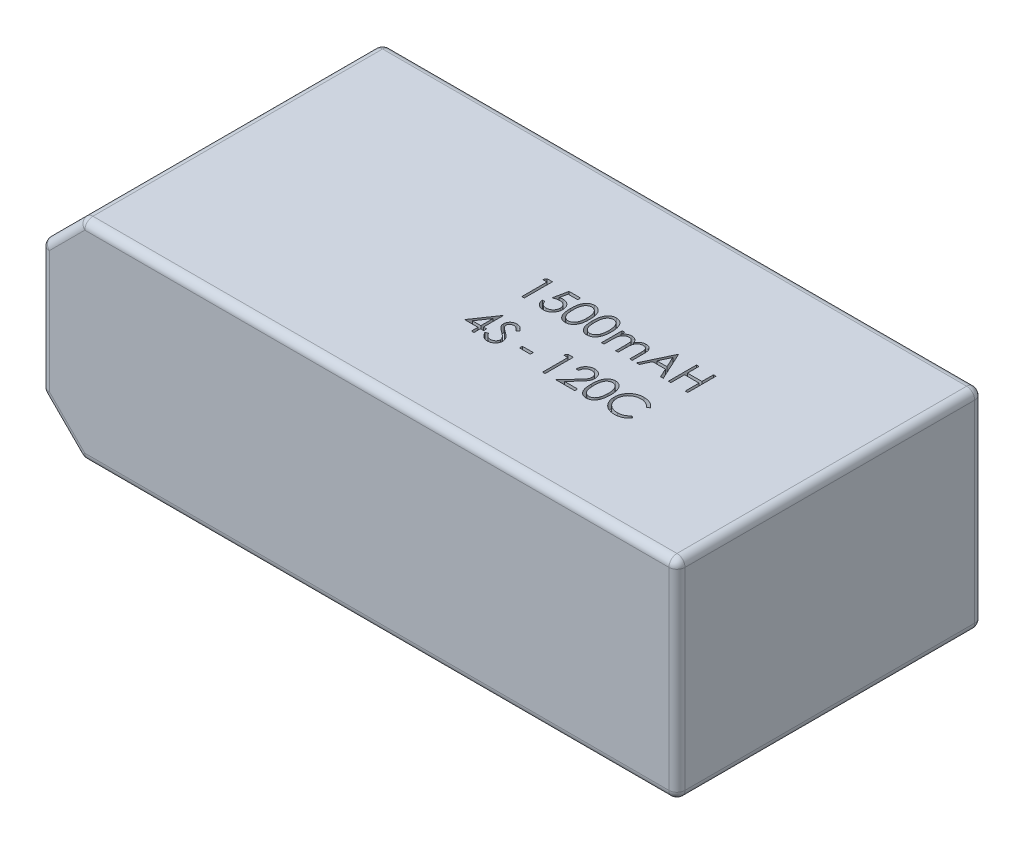
from build123d import *

# Parameters (mm, degrees)
SKETCH1_W           = 79
SKETCH1_H           = 38
BOSS_EXTRUDE1_DEPTH = 13
CHAMFER1_SIZE       = 5
FILLET1_R           = 1
SKETCH2_W           = 1.346153846
SKETCH2_H           = 0.358974359
CUT_EXTRUDE1_DEPTH  = 1


with BuildPart() as part:
    # Sketch1 → Boss-Extrude1 (new, symmetric)
    with BuildSketch(Plane(origin=(0, 0, 0), x_dir=(1, 0, 0), z_dir=(0, 1, 0))):
        Rectangle(SKETCH1_W, SKETCH1_H)
    extrude(amount=BOSS_EXTRUDE1_DEPTH, both=True)

    # Chamfer1
    chamfer1_edges = [part.edges().sort_by_distance(p)[0] for p in [
        (-39.5, 13, 0),
        (-39.5, -13, 0),
    ]]
    chamfer(chamfer1_edges, length=CHAMFER1_SIZE)

    # Fillet1
    fillet1_edges = [part.edges().sort_by_distance(p)[0] for p in [
        (2.5, 13, 19),
        (-34.5, 13, 0),
        (2.5, -13, 19),
        (-39.5, 0, 19),
        (-37, -10.5, 19),
        (-37, 10.5, 19),
        (-39.5, 0, -19),
        (-39.5, -8, 0),
        (-39.5, 8, 0),
        (-37, -10.5, -19),
        (-37, 10.5, -19),
        (-34.5, -13, 0),
        (39.5, 13, 0),
        (2.5, -13, -19),
        (39.5, -13, 0),
        (2.5, 13, -19),
        (39.5, 0, 19),
        (39.5, 0, -19),
    ]]
    fillet(fillet1_edges, radius=FILLET1_R)

    # Sketch2 → Cut-Extrude1 (cut)
    # profile 1 of 14: a face of its own
    with BuildSketch(Plane(origin=(0, 13, 0), x_dir=(1, 0, 0), z_dir=(0, 1, 0))):
        Polygon((0.878505609, 3.5), (1.525641026, 3.5), (1.525641026, 0), (1.211538462, 0), (1.211538462, 3.141025641), (0.673076923, 3.141025641), align=None)
    # profile 2 of 14: a face of its own
    with BuildSketch(Plane(origin=(0, 13, 0), x_dir=(1, 0, 0), z_dir=(0, 1, 0))):
        with BuildLine():
            Line((5.025641026, 3.5), (5.025641026, 3.141025641))
            Line((5.025641026, 3.141025641), (3.835136218, 3.141025641))
            Line((3.835136218, 3.141025641), (3.646534455, 2.220452724))
            add(Edge.make_bspline(
                [(3.646534455, 2.220452724), (3.68359033, 2.230682996), (3.755380225, 2.25050253), (3.861340086, 2.2725083), (3.96193229, 2.285773744), (4.02720766, 2.287585055), (4.058794071, 2.288461538)],
                knots=[0, 0, 0, 0, 1.100273476, 2.13160584, 3.095893838, 4, 4, 4, 4], degree=3))
            add(Edge.make_bspline(
                [(4.058794071, 2.288461538), (4.09787781, 2.287615603), (4.174726208, 2.285952282), (4.287165155, 2.269980432), (4.394498048, 2.244840518), (4.496500418, 2.209719996), (4.593360969, 2.164810263), (4.68418853, 2.108710322), (4.770346443, 2.043176991), (4.850289037, 1.967831979), (4.922813345, 1.884910363), (4.986579335, 1.795752492), (5.040741925, 1.701224829), (5.08430268, 1.600424221), (5.119087014, 1.494465067), (5.142239009, 1.382232485), (5.157655718, 1.264784365), (5.159378104, 1.184479795), (5.16025641, 1.143529647)],
                knots=[0, 0, 0, 0, 1.052922333, 2.070308379, 3.05430497, 4.020497103, 4.973039431, 5.925935799, 6.892292201, 7.88610001, 8.88166317, 9.857072816, 10.836096531, 11.812156883, 12.81219415, 13.836441305, 14.89672472, 16, 16, 16, 16], degree=3))
            add(Edge.make_bspline(
                [(5.16025641, 1.143529647), (5.159591335, 1.115007427), (5.158270172, 1.05834844), (5.151551585, 0.974204239), (5.138615869, 0.891841406), (5.121248145, 0.811249014), (5.098705727, 0.732579642), (5.071416673, 0.655608114), (5.038020645, 0.580813507), (5.00138927, 0.507488112), (4.960142792, 0.437289605), (4.914364285, 0.371640618), (4.865998793, 0.309556337), (4.813957408, 0.251702604), (4.757756413, 0.198459586), (4.698076446, 0.149511304), (4.635393727, 0.104029974), (4.568738485, 0.063861779), (4.499596002, 0.026898823), (4.426967784, -0.003424715), (4.352507084, -0.030535243), (4.275142208, -0.05214477), (4.195048396, -0.069077325), (4.11209362, -0.080577925), (4.02671295, -0.088954363), (3.968837938, -0.08947872), (3.939603365, -0.08974359)],
                knots=[0, 0, 0, 0, 1.056347294, 2.098418968, 3.122841568, 4.141288669, 5.149314143, 6.15115421, 7.162517403, 8.180376062, 9.185164535, 10.17417709, 11.141909838, 12.097768115, 13.052685741, 14.0056014, 14.954263652, 15.917497458, 16.885230207, 17.854509472, 18.828990115, 19.81800267, 20.826176721, 21.857883937, 22.917946725, 24, 24, 24, 24], degree=3))
            add(Edge.make_bspline(
                [(3.939603365, -0.08974359), (3.904729185, -0.089052752), (3.836118354, -0.08769361), (3.735597787, -0.073475124), (3.638883181, -0.053111208), (3.54675308, -0.022474938), (3.458381816, 0.015912357), (3.374959099, 0.064428528), (3.294353323, 0.119407632), (3.219841286, 0.184287985), (3.150685172, 0.255203667), (3.088778663, 0.332161308), (3.033645087, 0.41389075), (2.98616734, 0.500788904), (2.945669318, 0.592627435), (2.91385433, 0.689750436), (2.888175975, 0.79165044), (2.877312555, 0.86180395), (2.871794872, 0.897435897)],
                knots=[0, 0, 0, 0, 1.0467383, 2.05933395, 3.04377827, 4.011590433, 4.970194871, 5.932262533, 6.905835911, 7.896367577, 8.894135286, 9.877477877, 10.858688626, 11.851381753, 12.8477658, 13.868841284, 14.917554742, 16, 16, 16, 16], degree=3))
            Line((2.871794872, 0.897435897), (3.185897436, 0.897435897))
            add(Edge.make_bspline(
                [(3.185897436, 0.897435897), (3.193625993, 0.864059445), (3.20848071, 0.79990805), (3.241086458, 0.709776709), (3.280952334, 0.629457485), (3.328356682, 0.557887902), (3.384906713, 0.495478905), (3.449436142, 0.439861843), (3.521783865, 0.389686713), (3.602177095, 0.347863946), (3.686990174, 0.312195193), (3.775757384, 0.288443498), (3.86606173, 0.271742605), (3.927140101, 0.270070844), (3.957832532, 0.269230769)],
                knots=[0, 0, 0, 0, 1.136247022, 2.183929868, 3.172523383, 4.106158343, 5.02341133, 5.958108904, 6.928429099, 7.938127109, 8.96079061, 9.975095812, 10.982467395, 12, 12, 12, 12], degree=3))
            add(Edge.make_bspline(
                [(3.957832532, 0.269230769), (3.987790976, 0.270051547), (4.046779399, 0.271667666), (4.133590785, 0.284106678), (4.21740366, 0.303264249), (4.297391016, 0.331934104), (4.374952556, 0.366778822), (4.448126326, 0.411493898), (4.519029203, 0.462953917), (4.585457337, 0.521910547), (4.646296786, 0.586880241), (4.700052907, 0.656357635), (4.744829821, 0.730474481), (4.78256393, 0.807947634), (4.811217228, 0.889626191), (4.83165821, 0.975127366), (4.843661269, 1.064662347), (4.845312449, 1.125731656), (4.846153846, 1.156850962)],
                knots=[0, 0, 0, 0, 1.027316725, 2.022795036, 3.002884548, 3.971462791, 4.93288096, 5.914575861, 6.907176829, 7.935150275, 8.956128384, 9.956726525, 10.942570165, 11.921478529, 12.907843606, 13.90538589, 14.932640048, 16, 16, 16, 16], degree=3))
            add(Edge.make_bspline(
                [(4.846153846, 1.156850962), (4.845495367, 1.184926713), (4.844206487, 1.239881002), (4.833675917, 1.320280209), (4.815358944, 1.396353251), (4.789935064, 1.468467485), (4.757655557, 1.536690927), (4.718209244, 1.601093987), (4.670855846, 1.660827821), (4.616763958, 1.715920374), (4.557505917, 1.766765249), (4.492062174, 1.810109336), (4.421802247, 1.846573253), (4.347572648, 1.878041252), (4.267607749, 1.900641997), (4.183491117, 1.917609882), (4.094314409, 1.927425245), (4.033343721, 1.928787134), (4.002003205, 1.929487179)],
                knots=[0, 0, 0, 0, 1.045622112, 2.046656509, 3.013763289, 3.955457236, 4.890082067, 5.820317437, 6.762574623, 7.722996705, 8.69280354, 9.665887285, 10.63943826, 11.638615906, 12.663482002, 13.728887084, 14.832589034, 16, 16, 16, 16], degree=3))
            add(Edge.make_bspline(
                [(4.002003205, 1.929487179), (3.974874276, 1.928906588), (3.918859921, 1.927707815), (3.832937094, 1.918881318), (3.742645371, 1.904642024), (3.648330876, 1.885055776), (3.549710368, 1.859424699), (3.446991967, 1.828710199), (3.3399597, 1.7919882), (3.267841976, 1.764255986), (3.230769231, 1.75)],
                knots=[0, 0, 0, 0, 0.817624296, 1.688186739, 2.600797293, 3.572016777, 4.590301741, 5.671205678, 6.80286297, 8, 8, 8, 8], degree=3))
            Line((3.230769231, 1.75), (3.58974359, 3.5))
            Line((3.58974359, 3.5), (5.025641026, 3.5))
        make_face()
    # profile 3 of 14: a face of its own
    with BuildSketch(Plane(origin=(0, 13, 0), x_dir=(1, 0, 0), z_dir=(0, 1, 0))):
        with BuildLine():
            add(Edge.make_bspline(
                [(5.519230769, 1.748597756), (5.519558787, 1.804695144), (5.520195967, 1.913665128), (5.527284388, 2.07244977), (5.539059731, 2.221410059), (5.555197103, 2.360553125), (5.574835084, 2.48991489), (5.60105057, 2.609149647), (5.630863373, 2.718809254), (5.665415819, 2.819251302), (5.704403608, 2.911829005), (5.746837868, 2.998254207), (5.794402663, 3.078396139), (5.844379576, 3.153533929), (5.898791647, 3.222437624), (5.956090438, 3.286080287), (6.018512314, 3.342991037), (6.083935322, 3.394837339), (6.152951787, 3.440286811), (6.223594453, 3.48031955), (6.296349559, 3.514519417), (6.371415742, 3.541409853), (6.4481183, 3.5636207), (6.526725366, 3.578809647), (6.60736673, 3.588366556), (6.661798165, 3.589280224), (6.689403045, 3.58974359)],
                knots=[0, 0, 0, 0, 1.646270934, 3.197905019, 4.663502075, 6.030701355, 7.308322542, 8.50163776, 9.611534131, 10.641858119, 11.616356847, 12.558055219, 13.465016945, 14.349605745, 15.204443733, 16.039544428, 16.859896111, 17.680448484, 18.487036065, 19.28249412, 20.06191084, 20.843045899, 21.620316918, 22.403196591, 23.190181807, 24, 24, 24, 24], degree=3))
            add(Edge.make_bspline(
                [(6.689403045, 3.58974359), (6.717238523, 3.589255775), (6.772594532, 3.588285664), (6.854434907, 3.578961721), (6.934384589, 3.563490598), (7.012102728, 3.541569623), (7.088227714, 3.514373947), (7.162164122, 3.48028683), (7.234371204, 3.440607962), (7.303701491, 3.393984085), (7.370916107, 3.342001809), (7.43436407, 3.28323914), (7.494051155, 3.218289421), (7.550726461, 3.147847557), (7.602782058, 3.070562472), (7.65235549, 2.987778362), (7.696727526, 2.898047497), (7.739462201, 2.80286703), (7.776349188, 2.699603371), (7.809615433, 2.58883861), (7.836494402, 2.469264423), (7.858883674, 2.341508178), (7.87622857, 2.205100695), (7.888861212, 2.060334379), (7.895534297, 1.907113989), (7.896790999, 1.80235614), (7.897435897, 1.748597756)],
                knots=[0, 0, 0, 0, 0.810914788, 1.612654377, 2.396697861, 3.181598691, 3.963628158, 4.749916497, 5.551656086, 6.361998678, 7.18212741, 8.025565596, 8.878627764, 9.750805457, 10.657531673, 11.591944965, 12.560506719, 13.57287815, 14.630710178, 15.753379473, 16.941251878, 18.199788006, 19.531962791, 20.947069417, 22.433333509, 24, 24, 24, 24], degree=3))
            add(Edge.make_bspline(
                [(7.897435897, 1.748597756), (7.896784313, 1.695073848), (7.895514727, 1.590784697), (7.88893602, 1.438253721), (7.875977389, 1.294255678), (7.859767401, 1.158445216), (7.837316438, 1.031387597), (7.809711272, 0.912643148), (7.779060949, 0.801699077), (7.741226155, 0.699464265), (7.699815444, 0.604512542), (7.654760248, 0.515845394), (7.606490422, 0.432679101), (7.553901677, 0.355679354), (7.497848264, 0.284300697), (7.437130475, 0.219803074), (7.37345989, 0.160632402), (7.306047474, 0.107980775), (7.235635923, 0.06189597), (7.163676846, 0.02068212), (7.088893463, -0.012550575), (7.01298051, -0.041085616), (6.934852144, -0.062886068), (6.854605753, -0.077959923), (6.772649517, -0.088531772), (6.717247952, -0.089338252), (6.689403045, -0.08974359)],
                knots=[0, 0, 0, 0, 1.561518951, 3.042555995, 4.452378317, 5.7783523, 7.031515105, 8.214008947, 9.334062868, 10.386615937, 11.391082383, 12.354592575, 13.286541444, 14.194233754, 15.072674879, 15.931287219, 16.775624067, 17.606195743, 18.42308326, 19.229000347, 20.022332153, 20.807536673, 21.593273796, 22.3848459, 23.188221202, 24, 24, 24, 24], degree=3))
            add(Edge.make_bspline(
                [(6.689403045, -0.08974359), (6.661798931, -0.089277234), (6.607369006, -0.088357672), (6.526716581, -0.078843941), (6.448434137, -0.063548438), (6.372135383, -0.042131834), (6.297428868, -0.015916997), (6.225332581, 0.018236686), (6.155044898, 0.057570755), (6.086753342, 0.102366177), (6.021741181, 0.15368786), (5.959642575, 0.210452149), (5.902017556, 0.27407556), (5.848383461, 0.343553483), (5.797409372, 0.418246725), (5.750519999, 0.499175098), (5.707149145, 0.586017709), (5.667505654, 0.67933562), (5.632356991, 0.780490547), (5.601309283, 0.890639726), (5.576795125, 1.010755362), (5.55581217, 1.139872729), (5.538887787, 1.278546659), (5.527333462, 1.426852438), (5.520192147, 1.584697647), (5.519557076, 1.692967421), (5.519230769, 1.748597756)],
                knots=[0, 0, 0, 0, 0.810891512, 1.598919785, 2.382837074, 3.152667961, 3.926044502, 4.706494248, 5.493654104, 6.291793342, 7.103789334, 7.925228297, 8.761435821, 9.622817696, 10.50288917, 11.416980706, 12.369136599, 13.353924996, 14.394355917, 15.514179734, 16.714354668, 17.994756427, 19.357759367, 20.818452758, 22.365282078, 24, 24, 24, 24], degree=3))
        make_face()
        with BuildLine():
            add(Edge.make_bspline(
                [(5.833333333, 1.75), (5.83345278, 1.703251301), (5.833684604, 1.612521256), (5.839740804, 1.480677995), (5.847991036, 1.357707667), (5.858632333, 1.24345413), (5.874435282, 1.138304118), (5.89214207, 1.041534435), (5.913690159, 0.953657197), (5.939185177, 0.874069387), (5.968224274, 0.801420318), (5.999930138, 0.733819103), (6.033990861, 0.670467167), (6.072110011, 0.611933558), (6.113625075, 0.558027394), (6.157598334, 0.507794562), (6.205670918, 0.462997581), (6.27217466, 0.409270726), (6.359971135, 0.353751592), (6.47059159, 0.305405502), (6.584260041, 0.275023046), (6.661411291, 0.27115929), (6.699919872, 0.269230769)],
                knots=[0, 0, 0, 0, 1.459021318, 2.831673884, 4.118529203, 5.306027144, 6.411944654, 7.436330062, 8.375795394, 9.233974572, 10.042671642, 10.816086306, 11.563610507, 12.285937304, 12.993564865, 13.685989202, 14.367179055, 15.041617293, 16.353048772, 17.594441528, 18.799311195, 20, 20, 20, 20], degree=3))
            add(Edge.make_bspline(
                [(6.699919872, 0.269230769), (6.738677543, 0.27082855), (6.816112867, 0.274020813), (6.929246662, 0.30481955), (7.039076932, 0.35128909), (7.125148872, 0.406236595), (7.190631416, 0.458564925), (7.237548406, 0.503179573), (7.280610454, 0.55313544), (7.321452529, 0.607034736), (7.358911605, 0.66590722), (7.392974742, 0.729469796), (7.42405809, 0.797898973), (7.441767136, 0.845668713), (7.450821314, 0.870092147)],
                knots=[0, 0, 0, 0, 1.353760809, 2.704726607, 4.075137775, 5.516104923, 6.260822281, 7.007110065, 7.778089737, 8.566572457, 9.372053459, 10.217411131, 11.088608312, 12, 12, 12, 12], degree=3))
            add(Edge.make_bspline(
                [(7.450821314, 0.870092147), (7.461373082, 0.901321887), (7.482797696, 0.964731651), (7.51040947, 1.063095303), (7.532154869, 1.166298067), (7.551718235, 1.273723184), (7.565071291, 1.386162885), (7.575819104, 1.503269269), (7.582149791, 1.625130631), (7.582934542, 1.707925622), (7.583333333, 1.75)],
                knots=[0, 0, 0, 0, 0.884706709, 1.796334032, 2.740027952, 3.714592787, 4.726048262, 5.777819803, 6.87074269, 8, 8, 8, 8], degree=3))
            add(Edge.make_bspline(
                [(7.583333333, 1.75), (7.582783144, 1.792067573), (7.581706856, 1.874360737), (7.577592869, 1.994878918), (7.566969294, 2.109346679), (7.555170175, 2.218257152), (7.537772954, 2.321007454), (7.519015147, 2.418457759), (7.493813935, 2.509400784), (7.46689416, 2.595260366), (7.436083765, 2.675061021), (7.40216803, 2.749174807), (7.365946271, 2.817959532), (7.326604031, 2.881226473), (7.284608348, 2.939259016), (7.238850799, 2.990893611), (7.191146426, 3.037730579), (7.12432924, 3.091193148), (7.03685495, 3.145704843), (6.928009303, 3.195870603), (6.814738659, 3.224678896), (6.738165205, 3.228740583), (6.699919872, 3.230769231)],
                knots=[0, 0, 0, 0, 1.31362396, 2.569729283, 3.763502607, 4.902122613, 5.988968491, 7.01645872, 7.998833611, 8.933434873, 9.825090667, 10.667526885, 11.477055099, 12.250526234, 12.991942729, 13.710640831, 14.402115721, 15.076753259, 16.378508321, 17.609869233, 18.806226677, 20, 20, 20, 20], degree=3))
            add(Edge.make_bspline(
                [(6.699919872, 3.230769231), (6.66120928, 3.228737784), (6.583717574, 3.22467119), (6.469269619, 3.195977936), (6.359565268, 3.14596497), (6.272322293, 3.091012598), (6.205458507, 3.038674287), (6.158375813, 2.993287833), (6.114229641, 2.943641578), (6.073561941, 2.889239663), (6.035472658, 2.830774296), (6.000491645, 2.767785531), (5.968974315, 2.699954167), (5.939889779, 2.627337732), (5.914316991, 2.547756787), (5.893223028, 2.459987794), (5.873735975, 2.363525902), (5.859940706, 2.257806394), (5.84767695, 2.14352424), (5.839795602, 2.020246922), (5.833664345, 1.888182542), (5.83344588, 1.796983383), (5.833333333, 1.75)],
                knots=[0, 0, 0, 0, 1.207732386, 2.417664972, 3.655092373, 4.956220595, 5.625982001, 6.301752483, 6.994047911, 7.697131622, 8.419323945, 9.170223765, 9.943494443, 10.752040957, 11.610060368, 12.549350801, 13.567764191, 14.679664412, 15.874934091, 17.154273443, 18.533957287, 20, 20, 20, 20], degree=3))
        make_face(mode=Mode.SUBTRACT)
    # profile 4 of 14: a face of its own
    with BuildSketch(Plane(origin=(0, 13, 0), x_dir=(1, 0, 0), z_dir=(0, 1, 0))):
        with BuildLine():
            add(Edge.make_bspline(
                [(8.211538462, 1.748597756), (8.21186648, 1.804695144), (8.21250366, 1.913665128), (8.219592081, 2.07244977), (8.231367423, 2.221410059), (8.247504796, 2.360553125), (8.267142776, 2.48991489), (8.293358263, 2.609149647), (8.323171065, 2.718809254), (8.357723511, 2.819251302), (8.3967113, 2.911829005), (8.439145561, 2.998254207), (8.486710355, 3.078396139), (8.536687268, 3.153533929), (8.59109934, 3.222437624), (8.64839813, 3.286080287), (8.710820007, 3.342991037), (8.776243015, 3.394837339), (8.845259479, 3.440286811), (8.915902145, 3.48031955), (8.988657251, 3.514519417), (9.063723434, 3.541409853), (9.140425992, 3.5636207), (9.219033059, 3.578809647), (9.299674423, 3.588366556), (9.354105857, 3.589280224), (9.381710737, 3.58974359)],
                knots=[0, 0, 0, 0, 1.646270934, 3.197905019, 4.663502075, 6.030701355, 7.308322542, 8.50163776, 9.611534131, 10.641858119, 11.616356847, 12.558055219, 13.465016945, 14.349605745, 15.204443733, 16.039544428, 16.859896111, 17.680448484, 18.487036065, 19.28249412, 20.06191084, 20.843045899, 21.620316918, 22.403196591, 23.190181807, 24, 24, 24, 24], degree=3))
            add(Edge.make_bspline(
                [(9.381710737, 3.58974359), (9.409546216, 3.589255775), (9.464902225, 3.588285664), (9.5467426, 3.578961721), (9.626692282, 3.563490598), (9.70441042, 3.541569623), (9.780535407, 3.514373947), (9.854471814, 3.48028683), (9.926678896, 3.440607962), (9.996009183, 3.393984085), (10.063223799, 3.342001809), (10.126671762, 3.28323914), (10.186358848, 3.218289421), (10.243034153, 3.147847557), (10.29508975, 3.070562472), (10.344663183, 2.987778362), (10.389035218, 2.898047497), (10.431769894, 2.80286703), (10.46865688, 2.699603371), (10.501923126, 2.58883861), (10.528802094, 2.469264423), (10.551191367, 2.341508178), (10.568536262, 2.205100695), (10.581168905, 2.060334379), (10.58784199, 1.907113989), (10.589098691, 1.80235614), (10.58974359, 1.748597756)],
                knots=[0, 0, 0, 0, 0.810914788, 1.612654377, 2.396697861, 3.181598691, 3.963628158, 4.749916497, 5.551656086, 6.361998678, 7.18212741, 8.025565596, 8.878627764, 9.750805457, 10.657531673, 11.591944965, 12.560506719, 13.57287815, 14.630710178, 15.753379473, 16.941251878, 18.199788006, 19.531962791, 20.947069417, 22.433333509, 24, 24, 24, 24], degree=3))
            add(Edge.make_bspline(
                [(10.58974359, 1.748597756), (10.589092005, 1.695073848), (10.587822419, 1.590784697), (10.581243713, 1.438253721), (10.568285081, 1.294255678), (10.552075093, 1.158445216), (10.52962413, 1.031387597), (10.502018964, 0.912643148), (10.471368641, 0.801699077), (10.433533847, 0.699464265), (10.392123137, 0.604512542), (10.34706794, 0.515845394), (10.298798114, 0.432679101), (10.246209369, 0.355679354), (10.190155956, 0.284300697), (10.129438167, 0.219803074), (10.065767582, 0.160632402), (9.998355166, 0.107980775), (9.927943615, 0.06189597), (9.855984538, 0.02068212), (9.781201155, -0.012550575), (9.705288202, -0.041085616), (9.627159836, -0.062886068), (9.546913445, -0.077959923), (9.464957209, -0.088531772), (9.409555644, -0.089338252), (9.381710737, -0.08974359)],
                knots=[0, 0, 0, 0, 1.561518951, 3.042555995, 4.452378317, 5.7783523, 7.031515105, 8.214008947, 9.334062868, 10.386615937, 11.391082383, 12.354592575, 13.286541444, 14.194233754, 15.072674879, 15.931287219, 16.775624067, 17.606195743, 18.42308326, 19.229000347, 20.022332153, 20.807536673, 21.593273796, 22.3848459, 23.188221202, 24, 24, 24, 24], degree=3))
            add(Edge.make_bspline(
                [(9.381710737, -0.08974359), (9.354106623, -0.089277234), (9.299676698, -0.088357672), (9.219024273, -0.078843941), (9.14074183, -0.063548438), (9.064443076, -0.042131834), (8.98973656, -0.015916997), (8.917640274, 0.018236686), (8.84735259, 0.057570755), (8.779061034, 0.102366177), (8.714048873, 0.15368786), (8.651950268, 0.210452149), (8.594325249, 0.27407556), (8.540691153, 0.343553483), (8.489717065, 0.418246725), (8.442827691, 0.499175098), (8.399456837, 0.586017709), (8.359813347, 0.67933562), (8.324664683, 0.780490547), (8.293616975, 0.890639726), (8.269102818, 1.010755362), (8.248119862, 1.139872729), (8.231195479, 1.278546659), (8.219641154, 1.426852438), (8.212499839, 1.584697647), (8.211864768, 1.692967421), (8.211538462, 1.748597756)],
                knots=[0, 0, 0, 0, 0.810891512, 1.598919785, 2.382837074, 3.152667961, 3.926044502, 4.706494248, 5.493654104, 6.291793342, 7.103789334, 7.925228297, 8.761435821, 9.622817696, 10.50288917, 11.416980706, 12.369136599, 13.353924996, 14.394355917, 15.514179734, 16.714354668, 17.994756427, 19.357759367, 20.818452758, 22.365282078, 24, 24, 24, 24], degree=3))
        make_face()
        with BuildLine():
            add(Edge.make_bspline(
                [(8.525641026, 1.75), (8.525760473, 1.703251301), (8.525992296, 1.612521256), (8.532048497, 1.480677995), (8.540298729, 1.357707667), (8.550940026, 1.24345413), (8.566742974, 1.138304118), (8.584449762, 1.041534435), (8.605997852, 0.953657197), (8.63149287, 0.874069387), (8.660531966, 0.801420318), (8.69223783, 0.733819103), (8.726298553, 0.670467167), (8.764417704, 0.611933558), (8.805932767, 0.558027394), (8.849906026, 0.507794562), (8.89797861, 0.462997581), (8.964482353, 0.409270726), (9.052278827, 0.353751592), (9.162899282, 0.305405502), (9.276567733, 0.275023046), (9.353718984, 0.27115929), (9.392227564, 0.269230769)],
                knots=[0, 0, 0, 0, 1.459021318, 2.831673884, 4.118529203, 5.306027144, 6.411944654, 7.436330062, 8.375795394, 9.233974572, 10.042671642, 10.816086306, 11.563610507, 12.285937304, 12.993564865, 13.685989202, 14.367179055, 15.041617293, 16.353048772, 17.594441528, 18.799311195, 20, 20, 20, 20], degree=3))
            add(Edge.make_bspline(
                [(9.392227564, 0.269230769), (9.430985236, 0.27082855), (9.508420559, 0.274020813), (9.621554354, 0.30481955), (9.731384624, 0.35128909), (9.817456564, 0.406236595), (9.882939108, 0.458564925), (9.929856098, 0.503179573), (9.972918146, 0.55313544), (10.013760221, 0.607034736), (10.051219297, 0.66590722), (10.085282435, 0.729469796), (10.116365782, 0.797898973), (10.134074828, 0.845668713), (10.143129006, 0.870092147)],
                knots=[0, 0, 0, 0, 1.353760809, 2.704726607, 4.075137775, 5.516104923, 6.260822281, 7.007110065, 7.778089737, 8.566572457, 9.372053459, 10.217411131, 11.088608312, 12, 12, 12, 12], degree=3))
            add(Edge.make_bspline(
                [(10.143129006, 0.870092147), (10.153680774, 0.901321887), (10.175105388, 0.964731651), (10.202717162, 1.063095303), (10.224462562, 1.166298067), (10.244025927, 1.273723184), (10.257378983, 1.386162885), (10.268126796, 1.503269269), (10.274457483, 1.625130631), (10.275242234, 1.707925622), (10.275641026, 1.75)],
                knots=[0, 0, 0, 0, 0.884706709, 1.796334032, 2.740027952, 3.714592787, 4.726048262, 5.777819803, 6.87074269, 8, 8, 8, 8], degree=3))
            add(Edge.make_bspline(
                [(10.275641026, 1.75), (10.275090836, 1.792067573), (10.274014549, 1.874360737), (10.269900561, 1.994878918), (10.259276986, 2.109346679), (10.247477868, 2.218257152), (10.230080647, 2.321007454), (10.21132284, 2.418457759), (10.186121627, 2.509400784), (10.159201852, 2.595260366), (10.128391457, 2.675061021), (10.094475723, 2.749174807), (10.058253964, 2.817959532), (10.018911723, 2.881226473), (9.97691604, 2.939259016), (9.931158491, 2.990893611), (9.883454118, 3.037730579), (9.816636932, 3.091193148), (9.729162643, 3.145704843), (9.620316995, 3.195870603), (9.507046351, 3.224678896), (9.430472897, 3.228740583), (9.392227564, 3.230769231)],
                knots=[0, 0, 0, 0, 1.31362396, 2.569729283, 3.763502607, 4.902122613, 5.988968491, 7.01645872, 7.998833611, 8.933434873, 9.825090667, 10.667526885, 11.477055099, 12.250526234, 12.991942729, 13.710640831, 14.402115721, 15.076753259, 16.378508321, 17.609869233, 18.806226677, 20, 20, 20, 20], degree=3))
            add(Edge.make_bspline(
                [(9.392227564, 3.230769231), (9.353516972, 3.228737784), (9.276025266, 3.22467119), (9.161577312, 3.195977936), (9.05187296, 3.14596497), (8.964629985, 3.091012598), (8.897766199, 3.038674287), (8.850683505, 2.993287833), (8.806537333, 2.943641578), (8.765869633, 2.889239663), (8.72778035, 2.830774296), (8.692799337, 2.767785531), (8.661282008, 2.699954167), (8.632197471, 2.627337732), (8.606624683, 2.547756787), (8.58553072, 2.459987794), (8.566043667, 2.363525902), (8.552248398, 2.257806394), (8.539984642, 2.14352424), (8.532103295, 2.020246922), (8.525972037, 1.888182542), (8.525753573, 1.796983383), (8.525641026, 1.75)],
                knots=[0, 0, 0, 0, 1.207732386, 2.417664972, 3.655092373, 4.956220595, 5.625982001, 6.301752483, 6.994047911, 7.697131622, 8.419323945, 9.170223765, 9.943494443, 10.752040957, 11.610060368, 12.549350801, 13.567764191, 14.679664412, 15.874934091, 17.154273443, 18.533957287, 20, 20, 20, 20], degree=3))
        make_face(mode=Mode.SUBTRACT)
    # profile 5 of 14: a face of its own
    with BuildSketch(Plane(origin=(0, 13, 0), x_dir=(1, 0, 0), z_dir=(0, 1, 0))):
        with BuildLine():
            Line((11.128205128, 2.557692308), (11.442307692, 2.557692308))
            Line((11.442307692, 2.557692308), (11.442307692, 2.11318109))
            add(Edge.make_bspline(
                [(11.442307692, 2.11318109), (11.470591642, 2.152068691), (11.524786402, 2.226581065), (11.613652054, 2.324771349), (11.702428167, 2.408099503), (11.766361549, 2.451842375), (11.797075321, 2.472856571)],
                knots=[0, 0, 0, 0, 1.134379233, 2.173579362, 3.122582517, 4, 4, 4, 4], degree=3))
            add(Edge.make_bspline(
                [(11.797075321, 2.472856571), (11.838939983, 2.492861936), (11.921937882, 2.532523149), (12.053357107, 2.572756708), (12.187831777, 2.597481809), (12.278639991, 2.600863183), (12.32431891, 2.602564103)],
                knots=[0, 0, 0, 0, 1.014936303, 2.012140481, 3.000054389, 4, 4, 4, 4], degree=3))
            add(Edge.make_bspline(
                [(12.32431891, 2.602564103), (12.355211907, 2.601518812), (12.416347486, 2.599450238), (12.506931576, 2.585990202), (12.594790188, 2.562724029), (12.679404217, 2.530316705), (12.759124896, 2.491070018), (12.832214094, 2.445020311), (12.897838302, 2.393323235), (12.955964354, 2.333644302), (13.008233379, 2.264307704), (13.056312226, 2.183443455), (13.100737438, 2.089235794), (13.125358747, 2.020869253), (13.138321314, 1.984875801)],
                knots=[0, 0, 0, 0, 1.009824226, 1.998387844, 2.986035974, 3.974953746, 4.955485308, 5.885931332, 6.793869504, 7.679848016, 8.601185859, 9.625726857, 10.749998409, 12, 12, 12, 12], degree=3))
            add(Edge.make_bspline(
                [(13.138321314, 1.984875801), (13.152032565, 2.009600221), (13.179014383, 2.058254406), (13.22432002, 2.127112668), (13.271787816, 2.19151946), (13.321822309, 2.251525884), (13.374246896, 2.306835614), (13.429308296, 2.357631516), (13.486693078, 2.40413173), (13.566485318, 2.458454889), (13.670297925, 2.516156071), (13.80118604, 2.566184515), (13.937336211, 2.597100643), (14.02975391, 2.600730916), (14.076422276, 2.602564103)],
                knots=[0, 0, 0, 0, 0.86119277, 1.694706429, 2.50939023, 3.298075842, 4.073795165, 4.829715201, 5.57930267, 6.321991688, 7.768977793, 9.186738141, 10.579381044, 12, 12, 12, 12], degree=3))
            add(Edge.make_bspline(
                [(14.076422276, 2.602564103), (14.119303738, 2.600946882), (14.203226925, 2.597781823), (14.32540419, 2.57292835), (14.439345996, 2.530250703), (14.544823072, 2.472017066), (14.639982885, 2.398837883), (14.722699194, 2.311769046), (14.792469558, 2.211426423), (14.838048198, 2.117034434), (14.868963462, 2.033699101), (14.888024696, 1.96269281), (14.904864391, 1.884541257), (14.918845636, 1.799150995), (14.929064189, 1.706220387), (14.936634904, 1.605901511), (14.941758978, 1.498116399), (14.94212105, 1.423750899), (14.942307692, 1.385416667)],
                knots=[0, 0, 0, 0, 1.209669288, 2.367440248, 3.500751976, 4.631527125, 5.755587489, 6.87532382, 8.007944318, 9.190864318, 9.82315674, 10.514484317, 11.263564316, 12.079023757, 12.955305781, 13.901327259, 14.918167583, 16, 16, 16, 16], degree=3))
            Line((14.942307692, 1.385416667), (14.942307692, 0))
            Line((14.942307692, 0), (14.628205128, 0))
            Line((14.628205128, 0), (14.628205128, 1.38681891))
            add(Edge.make_bspline(
                [(14.628205128, 1.38681891), (14.628127245, 1.419539484), (14.627977566, 1.482423451), (14.625283934, 1.572675902), (14.62020862, 1.654944259), (14.614273982, 1.729116348), (14.606030172, 1.795365136), (14.59538424, 1.853557555), (14.584106561, 1.904151366), (14.565370569, 1.960237414), (14.535422678, 2.022107624), (14.489805198, 2.0888312), (14.432335092, 2.146912), (14.365974935, 2.197330317), (14.29042649, 2.238323958), (14.207161767, 2.267599968), (14.116697716, 2.285722846), (14.054074927, 2.287528862), (14.021734776, 2.288461538)],
                knots=[0, 0, 0, 0, 1.253487763, 2.409012846, 3.458416907, 4.410876679, 5.259312806, 6.014470957, 6.676830364, 7.243083969, 8.276244668, 9.299465089, 10.325150304, 11.392391894, 12.482080715, 13.603491619, 14.762376348, 16, 16, 16, 16], degree=3))
            add(Edge.make_bspline(
                [(14.021734776, 2.288461538), (13.982064821, 2.287045381), (13.90366191, 2.284246516), (13.789216424, 2.255672643), (13.679245407, 2.212592392), (13.577030274, 2.150159935), (13.483002484, 2.075351571), (13.402102906, 1.986401975), (13.33527072, 1.885772048), (13.290016744, 1.792625346), (13.261427443, 1.708955902), (13.242550527, 1.63585853), (13.227867136, 1.552776962), (13.214096607, 1.460269472), (13.205108879, 1.357699291), (13.196940506, 1.24554089), (13.193119644, 1.123456931), (13.192585185, 1.038830242), (13.192307692, 0.994891827)],
                knots=[0, 0, 0, 0, 1.090531906, 2.155305635, 3.229839962, 4.33261226, 5.44038871, 6.529323825, 7.629011124, 8.757537029, 9.370236727, 10.061839251, 10.834451254, 11.692844982, 12.636905849, 13.66920014, 14.789842145, 16, 16, 16, 16], degree=3))
            Line((13.192307692, 0.994891827), (13.192307692, 0))
            Line((13.192307692, 0), (12.878205128, 0))
            Line((12.878205128, 0), (12.878205128, 1.300580929))
            add(Edge.make_bspline(
                [(12.878205128, 1.300580929), (12.878125697, 1.337274248), (12.87797288, 1.407868505), (12.875296563, 1.509102181), (12.870209941, 1.601183261), (12.864329393, 1.684004725), (12.855869214, 1.757416053), (12.846259452, 1.821810811), (12.834910841, 1.877027563), (12.816120957, 1.937590947), (12.787406489, 2.00431187), (12.741218227, 2.075452892), (12.683610646, 2.137720989), (12.61603977, 2.190879738), (12.540034088, 2.234821219), (12.456050687, 2.266480971), (12.364845775, 2.28490526), (12.301968069, 2.287253757), (12.26963141, 2.288461538)],
                knots=[0, 0, 0, 0, 1.320475261, 2.540461679, 3.643808994, 4.639130445, 5.527981419, 6.302341397, 6.981980563, 7.553956391, 8.582137848, 9.585246428, 10.591171744, 11.620968678, 12.668337649, 13.738356861, 14.836885341, 16, 16, 16, 16], degree=3))
            add(Edge.make_bspline(
                [(12.26963141, 2.288461538), (12.231615199, 2.286931078), (12.155850239, 2.283880926), (12.04454827, 2.256426652), (11.937062586, 2.213422577), (11.835107887, 2.153762758), (11.741433739, 2.07986368), (11.659425472, 1.992948784), (11.590482946, 1.89409975), (11.544751131, 1.801935234), (11.515252657, 1.720361959), (11.495657323, 1.651011011), (11.478817697, 1.574010763), (11.466303675, 1.489123652), (11.454223259, 1.396902558), (11.44839295, 1.296888068), (11.442721388, 1.18916598), (11.442448973, 1.114793435), (11.442307692, 1.076221955)],
                knots=[0, 0, 0, 0, 1.098833095, 2.189935336, 3.297829714, 4.440610912, 5.596351641, 6.740013378, 7.886572111, 9.072425424, 9.705826452, 10.395263256, 11.156850408, 11.985370555, 12.878090359, 13.847760091, 14.883794034, 16, 16, 16, 16], degree=3))
            Line((11.442307692, 1.076221955), (11.442307692, 0))
            Line((11.442307692, 0), (11.128205128, 0))
            Line((11.128205128, 0), (11.128205128, 2.557692308))
        make_face()
    # profile 6 of 14: a face of its own
    with BuildSketch(Plane(origin=(0, 13, 0), x_dir=(1, 0, 0), z_dir=(0, 1, 0))):
        Polygon((17.185897436, 3.5), (18.801282051, 0), (18.459835737, 0), (17.942407853, 1.121794872), (16.355769231, 1.121794872), (15.823617788, 0), (15.480769231, 0), (17.141025641, 3.5), align=None)
        Polygon((17.159955929, 2.817808494), (16.526141827, 1.480769231), (17.776943109, 1.480769231), align=None, mode=Mode.SUBTRACT)
    # profile 7 of 14: a face of its own
    with BuildSketch(Plane(origin=(0, 13, 0), x_dir=(1, 0, 0), z_dir=(0, 1, 0))):
        Polygon((19.429487179, 3.5), (19.743589744, 3.5), (19.743589744, 2.064102564), (21.538461538, 2.064102564), (21.538461538, 3.5), (21.852564103, 3.5), (21.852564103, 0), (21.538461538, 0), (21.538461538, 1.705128205), (19.743589744, 1.705128205), (19.743589744, 0), (19.429487179, 0), align=None)
    # profile 8 of 14: a face of its own
    with BuildSketch(Plane(origin=(0, 13, 0), x_dir=(1, 0, 0), z_dir=(0, 1, 0))):
        Polygon((2.045172276, -3.243589744), (2.108974359, -3.243589744), (2.108974359, -5.666666667), (2.512820513, -5.666666667), (2.512820513, -6.025641026), (2.108974359, -6.025641026), (2.108974359, -6.833333333), (1.794871795, -6.833333333), (1.794871795, -6.025641026), (0.134615385, -6.025641026), align=None)
        Polygon((1.794871795, -5.666666667), (1.794871795, -4.146634615), (0.751602564, -5.666666667), align=None, mode=Mode.SUBTRACT)
    # profile 9 of 14: a face of its own
    with BuildSketch(Plane(origin=(0, 13, 0), x_dir=(1, 0, 0), z_dir=(0, 1, 0))):
        with BuildLine():
            Line((2.782051282, -6.158153045), (3.077924679, -5.980769231))
            add(Edge.make_bspline(
                [(3.077924679, -5.980769231), (3.105442917, -6.026833616), (3.158166797, -6.1150912), (3.246118157, -6.23434924), (3.337251068, -6.335711397), (3.432240401, -6.418588004), (3.530506349, -6.483836891), (3.632690403, -6.530039123), (3.738448214, -6.558855098), (3.810422035, -6.562355185), (3.846354167, -6.564102564)],
                knots=[0, 0, 0, 0, 1.272034388, 2.437168799, 3.508375237, 4.49857839, 5.41946034, 6.295179144, 7.148887113, 8, 8, 8, 8], degree=3))
            add(Edge.make_bspline(
                [(3.846354167, -6.564102564), (3.877041027, -6.563247892), (3.9378778, -6.561553501), (4.027440043, -6.545272699), (4.114421845, -6.52026057), (4.197030483, -6.484439639), (4.274126098, -6.441101153), (4.341732793, -6.388754976), (4.400178906, -6.33014877), (4.447988021, -6.264766115), (4.484668056, -6.194448967), (4.512860124, -6.122273015), (4.528505198, -6.047104447), (4.530861952, -5.996493984), (4.532051282, -5.970953526)],
                knots=[0, 0, 0, 0, 1.095163259, 2.171163733, 3.241058638, 4.321873601, 5.38011039, 6.391990106, 7.366004449, 8.327778327, 9.272591725, 10.192022065, 11.087607919, 12, 12, 12, 12], degree=3))
            add(Edge.make_bspline(
                [(4.532051282, -5.970953526), (4.530576971, -5.941812676), (4.527579913, -5.882573587), (4.502248433, -5.795173934), (4.462399186, -5.708681364), (4.425636543, -5.655180098), (4.406550481, -5.627403846)],
                knots=[0, 0, 0, 0, 0.938893495, 1.908633276, 2.914225137, 4, 4, 4, 4], degree=3))
            add(Edge.make_bspline(
                [(4.406550481, -5.627403846), (4.390879867, -5.607357023), (4.357981372, -5.565271224), (4.30142386, -5.502625989), (4.235057745, -5.43800757), (4.16115419, -5.368948513), (4.077021102, -5.298660716), (3.985293587, -5.223792438), (3.883629728, -5.147190861), (3.812330232, -5.095818295), (3.775540865, -5.069310897)],
                knots=[0, 0, 0, 0, 0.722233717, 1.516239348, 2.393582979, 3.351407094, 4.387010283, 5.505090956, 6.712668013, 8, 8, 8, 8], degree=3))
            add(Edge.make_bspline(
                [(3.775540865, -5.069310897), (3.738716869, -5.04308231), (3.668312193, -4.992935248), (3.56985361, -4.918510964), (3.481809147, -4.850467094), (3.404570131, -4.788163082), (3.338170534, -4.731590477), (3.282087123, -4.681292538), (3.237748566, -4.635908977), (3.213092985, -4.606467635), (3.202023237, -4.593249199)],
                knots=[0, 0, 0, 0, 1.452282411, 2.77665338, 3.964542531, 5.026858415, 5.96415736, 6.766646006, 7.446254459, 8, 8, 8, 8], degree=3))
            add(Edge.make_bspline(
                [(3.202023237, -4.593249199), (3.186550692, -4.572648162), (3.156121855, -4.532133458), (3.11595585, -4.4688086), (3.081816687, -4.403985335), (3.055054355, -4.33748947), (3.032518136, -4.270254541), (3.017360205, -4.201403296), (3.007868808, -4.131244677), (3.006896822, -4.084031177), (3.006410256, -4.060396635)],
                knots=[0, 0, 0, 0, 1.068054152, 2.10047183, 3.106115577, 4.101338837, 5.06977816, 6.043150881, 7.020423561, 8, 8, 8, 8], degree=3))
            add(Edge.make_bspline(
                [(3.006410256, -4.060396635), (3.007715465, -4.02336686), (3.010297985, -3.950098796), (3.032138503, -3.843067966), (3.066611396, -3.740881549), (3.114906284, -3.644551215), (3.177163637, -3.556585234), (3.249209612, -3.475971747), (3.335021098, -3.408203165), (3.429173721, -3.348991106), (3.532230093, -3.302645181), (3.640220997, -3.267684201), (3.753318069, -3.247874943), (3.829921203, -3.245032178), (3.868790064, -3.243589744)],
                knots=[0, 0, 0, 0, 1.005424448, 1.989358655, 2.955360095, 3.929531133, 4.905563448, 5.876582895, 6.856512386, 7.866279853, 8.892233794, 9.918561126, 10.94386622, 12, 12, 12, 12], degree=3))
            add(Edge.make_bspline(
                [(3.868790064, -3.243589744), (3.910034164, -3.245012295), (3.992055516, -3.247841296), (4.112704732, -3.272438828), (4.228865448, -3.313139499), (4.322308713, -3.359328157), (4.395441474, -3.405459573), (4.451214207, -3.447479397), (4.507731658, -3.495854506), (4.565449713, -3.550713752), (4.623390372, -3.612560503), (4.682413824, -3.680971192), (4.742658093, -3.755527748), (4.781413953, -3.808752249), (4.801282051, -3.83603766)],
                knots=[0, 0, 0, 0, 1.286793592, 2.559021753, 3.825965368, 5.121522368, 5.803751409, 6.523245864, 7.299691795, 8.125521123, 9.008227632, 9.944561021, 10.946284179, 12, 12, 12, 12], degree=3))
            Line((4.801282051, -3.83603766), (4.517327724, -4.051282051))
            add(Edge.make_bspline(
                [(4.517327724, -4.051282051), (4.500181792, -4.029193361), (4.467162735, -3.986655708), (4.417033248, -3.927084392), (4.3697846, -3.872667912), (4.3232342, -3.825402784), (4.279840569, -3.782700651), (4.237723527, -3.746140894), (4.197489175, -3.715365299), (4.146772265, -3.682521739), (4.083054546, -3.649965235), (4.00307001, -3.622416157), (3.919483735, -3.605861095), (3.862554104, -3.603672208), (3.833733974, -3.602564103)],
                knots=[0, 0, 0, 0, 1.181633172, 2.275549214, 3.290209073, 4.226197932, 5.078386478, 5.862611352, 6.581680152, 7.217281963, 8.414376989, 9.595101626, 10.782541182, 12, 12, 12, 12], degree=3))
            add(Edge.make_bspline(
                [(3.833733974, -3.602564103), (3.797577452, -3.603775803), (3.727853005, -3.606112452), (3.628862768, -3.631632437), (3.539768843, -3.671814297), (3.463216278, -3.728129275), (3.399479301, -3.794850268), (3.353373843, -3.871629123), (3.325623678, -3.956411526), (3.322237398, -4.015553182), (3.320512821, -4.045673077)],
                knots=[0, 0, 0, 0, 1.14458467, 2.207223713, 3.21896685, 4.227309161, 5.202851033, 6.127160689, 7.046193047, 8, 8, 8, 8], degree=3))
            add(Edge.make_bspline(
                [(3.320512821, -4.045673077), (3.320905947, -4.064424555), (3.321692843, -4.101958175), (3.332667641, -4.157409597), (3.34676697, -4.212720936), (3.369109602, -4.267643519), (3.399954905, -4.323137878), (3.440460081, -4.380159616), (3.491473393, -4.439211324), (3.530550406, -4.477618698), (3.551181891, -4.497896635)],
                knots=[0, 0, 0, 0, 0.858281714, 1.717966888, 2.583508476, 3.4729293, 4.427298488, 5.488583878, 6.674047936, 8, 8, 8, 8], degree=3))
            add(Edge.make_bspline(
                [(3.551181891, -4.497896635), (3.558843263, -4.50473366), (3.577044931, -4.520976869), (3.610320856, -4.547569149), (3.654263655, -4.580371922), (3.707725856, -4.620959238), (3.771693217, -4.6680407), (3.846172774, -4.721014312), (3.930334306, -4.781599771), (3.990056222, -4.823957312), (4.021634615, -4.846354167)],
                knots=[0, 0, 0, 0, 0.420754252, 0.999615792, 1.744751191, 2.668019286, 3.750313428, 4.999500688, 6.413464383, 8, 8, 8, 8], degree=3))
            add(Edge.make_bspline(
                [(4.021634615, -4.846354167), (4.059620529, -4.873995526), (4.133174985, -4.927519188), (4.237832565, -5.007934868), (4.332726373, -5.086582637), (4.418189577, -5.162960244), (4.495066485, -5.236488337), (4.562504206, -5.308051517), (4.621189886, -5.37713709), (4.684369105, -5.465709665), (4.748926924, -5.57449075), (4.804368432, -5.707768988), (4.839326779, -5.841565309), (4.843898294, -5.931492145), (4.846153846, -5.975861378)],
                knots=[0, 0, 0, 0, 1.163667725, 2.253281268, 3.268753668, 4.215851969, 5.092017293, 5.902905408, 6.650798638, 7.335211899, 8.59617414, 9.77448103, 10.901945474, 12, 12, 12, 12], degree=3))
            add(Edge.make_bspline(
                [(4.846153846, -5.975861378), (4.845496708, -6.007239743), (4.844195193, -6.069387127), (4.829234279, -6.160642204), (4.807314614, -6.249273073), (4.77427738, -6.334184186), (4.733954222, -6.416928949), (4.682787974, -6.495336849), (4.623480289, -6.571143248), (4.555446524, -6.642326739), (4.481000622, -6.707672935), (4.402316927, -6.765801996), (4.319266654, -6.81427032), (4.232300338, -6.853821162), (4.141398001, -6.884754679), (4.046590217, -6.907167548), (3.947720706, -6.920923259), (3.880520224, -6.922351021), (3.846354167, -6.923076923)],
                knots=[0, 0, 0, 0, 0.983748083, 1.948392443, 2.894712957, 3.844097841, 4.80183111, 5.778335162, 6.776009319, 7.81870978, 8.863265674, 9.881300176, 10.883814829, 11.87499822, 12.874611388, 13.892143829, 14.928324115, 16, 16, 16, 16], degree=3))
            add(Edge.make_bspline(
                [(3.846354167, -6.923076923), (3.819918824, -6.922565741), (3.767381064, -6.921549816), (3.689671582, -6.912568536), (3.613531993, -6.899861432), (3.539917711, -6.879687362), (3.467880299, -6.855210385), (3.397733064, -6.825072052), (3.329442011, -6.788954851), (3.262624428, -6.747659826), (3.197450253, -6.699602082), (3.134530785, -6.643628585), (3.0718016, -6.58128308), (3.011114203, -6.510872517), (2.951241059, -6.433534434), (2.893362649, -6.348545251), (2.836280932, -6.256367897), (2.800465464, -6.191502811), (2.782051282, -6.158153045)],
                knots=[0, 0, 0, 0, 0.915332311, 1.819136955, 2.706846663, 3.586547465, 4.459518054, 5.340707479, 6.227863349, 7.133153174, 8.059268498, 9.028702269, 10.047606654, 11.120612155, 12.245963614, 13.433783089, 14.680604001, 16, 16, 16, 16], degree=3))
        make_face()
    # profile 10 of 14: a face of its own
    with BuildSketch(Plane(origin=(0, 13, 0), x_dir=(1, 0, 0), z_dir=(0, 1, 0))):
        with Locations((7.269230769, -5.487179488)):
            Rectangle(SKETCH2_W, SKETCH2_H)
    # profile 11 of 14: a face of its own
    with BuildSketch(Plane(origin=(0, 13, 0), x_dir=(1, 0, 0), z_dir=(0, 1, 0))):
        Polygon((10.301582532, -3.333333333), (10.948717949, -3.333333333), (10.948717949, -6.833333333), (10.634615385, -6.833333333), (10.634615385, -3.692307692), (10.096153846, -3.692307692), align=None)
    # profile 12 of 14: a face of its own
    with BuildSketch(Plane(origin=(0, 13, 0), x_dir=(1, 0, 0), z_dir=(0, 1, 0))):
        with BuildLine():
            Line((12.698717949, -4.41025641), (12.384615385, -4.41025641))
            add(Edge.make_bspline(
                [(12.384615385, -4.41025641), (12.386662538, -4.368585522), (12.390683092, -4.286745008), (12.409511381, -4.167421102), (12.436452258, -4.053366303), (12.474543712, -3.945496389), (12.52184999, -3.842857582), (12.578580017, -3.745857566), (12.645773868, -3.654866377), (12.721980602, -3.570727534), (12.804749241, -3.493539963), (12.89405518, -3.42688472), (12.987900208, -3.370567049), (13.085999607, -3.323485807), (13.18946017, -3.288145961), (13.297343028, -3.261924322), (13.410122164, -3.246147976), (13.486962186, -3.24445219), (13.526041667, -3.243589744)],
                knots=[0, 0, 0, 0, 1.10065271, 2.161652631, 3.183658789, 4.190468796, 5.17591951, 6.163126047, 7.15150782, 8.156236427, 9.156009102, 10.134482811, 11.092018607, 12.041330605, 13.001268258, 13.972401359, 14.968799086, 16, 16, 16, 16], degree=3))
            add(Edge.make_bspline(
                [(13.526041667, -3.243589744), (13.564419741, -3.2444882), (13.639831285, -3.246253635), (13.7498933, -3.261414664), (13.854670594, -3.285160256), (13.953958361, -3.318475672), (14.046964425, -3.363260099), (14.13438747, -3.417057638), (14.217268281, -3.479277469), (14.291875064, -3.552531283), (14.360383144, -3.630733667), (14.419485399, -3.714221571), (14.470098562, -3.800450857), (14.512286242, -3.890079058), (14.543342381, -3.983950087), (14.566920589, -4.08069729), (14.580248003, -4.181322101), (14.582293426, -4.249428656), (14.583333333, -4.284054487)],
                knots=[0, 0, 0, 0, 1.111607364, 2.184268762, 3.212621178, 4.221274766, 5.211760367, 6.196651075, 7.1921475, 8.207485113, 9.220403448, 10.201281604, 11.166441695, 12.114753415, 13.065576456, 14.026450734, 14.996634279, 16, 16, 16, 16], degree=3))
            add(Edge.make_bspline(
                [(14.583333333, -4.284054487), (14.58164007, -4.332802322), (14.578283259, -4.429442535), (14.549568883, -4.571457398), (14.504722371, -4.709050817), (14.450725015, -4.819788119), (14.396252571, -4.909021613), (14.347165063, -4.982490318), (14.289700252, -5.061595786), (14.223021754, -5.146073124), (14.148508882, -5.236584029), (14.065486718, -5.333073824), (13.973363236, -5.434545594), (13.908704736, -5.503851195), (13.875200321, -5.539763622)],
                knots=[0, 0, 0, 0, 1.184426356, 2.348067706, 3.509069118, 4.696110526, 5.333549288, 6.050745305, 6.844228056, 7.710549037, 8.667450064, 9.695053472, 10.805634456, 12, 12, 12, 12], degree=3))
            Line((13.875200321, -5.539763622), (12.999499199, -6.474358974))
            Line((12.999499199, -6.474358974), (14.628205128, -6.474358974))
            Line((14.628205128, -6.474358974), (14.628205128, -6.833333333))
            Line((14.628205128, -6.833333333), (12.25, -6.833333333))
            Line((12.25, -6.833333333), (13.607371795, -5.384815705))
            add(Edge.make_bspline(
                [(13.607371795, -5.384815705), (13.640419682, -5.350317399), (13.703897909, -5.284053212), (13.793680486, -5.187310252), (13.874319474, -5.097560711), (13.946336867, -5.014974163), (14.008170372, -4.938342595), (14.063042604, -4.870147891), (14.107008195, -4.807393441), (14.154723591, -4.734652827), (14.200937572, -4.64584051), (14.240649928, -4.537306821), (14.264864777, -4.425579568), (14.267769612, -4.350077531), (14.269230769, -4.312099359)],
                knots=[0, 0, 0, 0, 1.329631726, 2.553950428, 3.673215718, 4.687767853, 5.603093632, 6.413772471, 7.123043292, 7.734684054, 8.834405432, 9.900288307, 10.943827018, 12, 12, 12, 12], degree=3))
            add(Edge.make_bspline(
                [(14.269230769, -4.312099359), (14.268595027, -4.288217961), (14.267342101, -4.24115231), (14.256284403, -4.172146551), (14.239573897, -4.105581737), (14.215628639, -4.041253118), (14.184021899, -3.979807466), (14.145548519, -3.921169986), (14.101158456, -3.864481021), (14.049807187, -3.811327723), (13.993395667, -3.762646517), (13.933801417, -3.719522432), (13.870751313, -3.683483321), (13.804511191, -3.653939824), (13.735265721, -3.630764443), (13.662880976, -3.614705863), (13.58755696, -3.604623379), (13.536123464, -3.603259207), (13.509915865, -3.602564103)],
                knots=[0, 0, 0, 0, 0.991446411, 1.95395049, 2.89581595, 3.838931463, 4.798493298, 5.75982156, 6.748411868, 7.785213223, 8.824556874, 9.840280684, 10.836137867, 11.835679398, 12.848801643, 13.863922112, 14.911575587, 16, 16, 16, 16], degree=3))
            add(Edge.make_bspline(
                [(13.509915865, -3.602564103), (13.482545033, -3.603279135), (13.428793236, -3.60468334), (13.349874203, -3.614506004), (13.274588426, -3.631451845), (13.202746523, -3.654628519), (13.134226937, -3.684087068), (13.069362893, -3.720778812), (13.008300004, -3.764562306), (12.950923481, -3.814202862), (12.898059501, -3.869470463), (12.851612626, -3.931080426), (12.811028611, -3.997907842), (12.775619378, -4.069772392), (12.746863688, -4.147326172), (12.724890537, -4.230293877), (12.707503691, -4.318315258), (12.70169517, -4.379100343), (12.698717949, -4.41025641)],
                knots=[0, 0, 0, 0, 1.031018746, 2.02475058, 2.990194455, 3.934040569, 4.864654155, 5.795059489, 6.735614925, 7.690564532, 8.649604399, 9.611025574, 10.590972636, 11.591080095, 12.624614302, 13.701020113, 14.821632451, 16, 16, 16, 16], degree=3))
        make_face()
    # profile 13 of 14: a face of its own
    with BuildSketch(Plane(origin=(0, 13, 0), x_dir=(1, 0, 0), z_dir=(0, 1, 0))):
        with BuildLine():
            add(Edge.make_bspline(
                [(14.942307692, -5.084735577), (14.94263571, -5.028638189), (14.94327289, -4.919668205), (14.950361311, -4.760883563), (14.962136654, -4.611923274), (14.978274027, -4.472780208), (14.997912007, -4.343418443), (15.024127493, -4.224183686), (15.053940296, -4.11452408), (15.088492742, -4.014082031), (15.127480531, -3.921504328), (15.169914792, -3.835079127), (15.217479586, -3.754937194), (15.267456499, -3.679799404), (15.321868571, -3.610895709), (15.379167361, -3.547253047), (15.441589237, -3.490342296), (15.507012246, -3.438495994), (15.57602871, -3.393046522), (15.646671376, -3.353013784), (15.719426482, -3.318813916), (15.794492665, -3.29192348), (15.871195223, -3.269712634), (15.949802289, -3.254523686), (16.030443653, -3.244966778), (16.084875088, -3.24405311), (16.112479968, -3.243589744)],
                knots=[0, 0, 0, 0, 1.646270934, 3.197905019, 4.663502075, 6.030701355, 7.308322542, 8.50163776, 9.611534131, 10.641858119, 11.616356847, 12.558055219, 13.465016945, 14.349605745, 15.204443733, 16.039544428, 16.859896111, 17.680448484, 18.487036065, 19.28249412, 20.06191084, 20.843045899, 21.620316918, 22.403196591, 23.190181807, 24, 24, 24, 24], degree=3))
            add(Edge.make_bspline(
                [(16.112479968, -3.243589744), (16.140315446, -3.244077559), (16.195671455, -3.24504767), (16.277511831, -3.254371612), (16.357461512, -3.269842735), (16.435179651, -3.29176371), (16.511304637, -3.318959387), (16.585241045, -3.353046504), (16.657448127, -3.392725371), (16.726778414, -3.439349248), (16.79399303, -3.491331525), (16.857440993, -3.550094193), (16.917128078, -3.615043913), (16.973803384, -3.685485776), (17.025858981, -3.762770861), (17.075432413, -3.845554971), (17.119804449, -3.935285836), (17.162539124, -4.030466304), (17.199426111, -4.133729963), (17.232692356, -4.244494723), (17.259571325, -4.36406891), (17.281960597, -4.491825155), (17.299305493, -4.628232638), (17.311938135, -4.772998954), (17.31861122, -4.926219345), (17.319867922, -5.030977194), (17.320512821, -5.084735577)],
                knots=[0, 0, 0, 0, 0.810914788, 1.612654377, 2.396697861, 3.181598691, 3.963628158, 4.749916497, 5.551656086, 6.361998678, 7.18212741, 8.025565596, 8.878627764, 9.750805457, 10.657531673, 11.591944965, 12.560506719, 13.57287815, 14.630710178, 15.753379473, 16.941251878, 18.199788006, 19.531962791, 20.947069417, 22.433333509, 24, 24, 24, 24], degree=3))
            add(Edge.make_bspline(
                [(17.320512821, -5.084735577), (17.319861236, -5.138259485), (17.31859165, -5.242548637), (17.312012943, -5.395079612), (17.299054312, -5.539077655), (17.282844324, -5.674888118), (17.260393361, -5.801945737), (17.232788195, -5.920690185), (17.202137872, -6.031634257), (17.164303078, -6.133869068), (17.122892367, -6.228820791), (17.077837171, -6.31748794), (17.029567345, -6.400654232), (16.9769786, -6.477653979), (16.920925187, -6.549032636), (16.860207398, -6.613530259), (16.796536813, -6.672700931), (16.729124397, -6.725352558), (16.658712846, -6.771437363), (16.586753769, -6.812651213), (16.511970386, -6.845883908), (16.436057433, -6.874418949), (16.357929067, -6.896219401), (16.277682676, -6.911293257), (16.19572644, -6.921865105), (16.140324875, -6.922671585), (16.112479968, -6.923076923)],
                knots=[0, 0, 0, 0, 1.561518951, 3.042555995, 4.452378317, 5.7783523, 7.031515105, 8.214008947, 9.334062868, 10.386615937, 11.391082383, 12.354592575, 13.286541444, 14.194233754, 15.072674879, 15.931287219, 16.775624067, 17.606195743, 18.42308326, 19.229000347, 20.022332153, 20.807536673, 21.593273796, 22.3848459, 23.188221202, 24, 24, 24, 24], degree=3))
            add(Edge.make_bspline(
                [(16.112479968, -6.923076923), (16.084875854, -6.922610568), (16.030445929, -6.921691006), (15.949793504, -6.912177274), (15.87151106, -6.896881771), (15.795212306, -6.875465167), (15.720505791, -6.849250331), (15.648409505, -6.815096647), (15.578121821, -6.775762578), (15.509830265, -6.730967157), (15.444818104, -6.679645473), (15.382719498, -6.622881185), (15.325094479, -6.559257773), (15.271460384, -6.48977985), (15.220486296, -6.415086608), (15.173596922, -6.334158235), (15.130226068, -6.247315624), (15.090582578, -6.153997714), (15.055433914, -6.052842786), (15.024386206, -5.942693607), (14.999872048, -5.822577971), (14.978889093, -5.693460604), (14.96196471, -5.554786674), (14.950410385, -5.406480896), (14.94326907, -5.248635687), (14.942633999, -5.140365912), (14.942307692, -5.084735577)],
                knots=[0, 0, 0, 0, 0.810891512, 1.598919785, 2.382837074, 3.152667961, 3.926044502, 4.706494248, 5.493654104, 6.291793342, 7.103789334, 7.925228297, 8.761435821, 9.622817696, 10.50288917, 11.416980706, 12.369136599, 13.353924996, 14.394355917, 15.514179734, 16.714354668, 17.994756427, 19.357759367, 20.818452758, 22.365282078, 24, 24, 24, 24], degree=3))
        make_face()
        with BuildLine():
            add(Edge.make_bspline(
                [(15.256410256, -5.083333333), (15.256529703, -5.130082032), (15.256761527, -5.220812077), (15.262817727, -5.352655338), (15.271067959, -5.475625667), (15.281709257, -5.589879203), (15.297512205, -5.695029216), (15.315218993, -5.791798899), (15.336767083, -5.879676136), (15.3622621, -5.959263947), (15.391301197, -6.031913015), (15.423007061, -6.09951423), (15.457067784, -6.162866167), (15.495186934, -6.221399775), (15.536701998, -6.275305939), (15.580675257, -6.325538771), (15.628747841, -6.370335753), (15.695251584, -6.424062608), (15.783048058, -6.479581742), (15.893668513, -6.527927831), (16.007336964, -6.558310288), (16.084488214, -6.562174044), (16.122996795, -6.564102564)],
                knots=[0, 0, 0, 0, 1.459021318, 2.831673884, 4.118529203, 5.306027144, 6.411944654, 7.436330062, 8.375795394, 9.233974572, 10.042671642, 10.816086306, 11.563610507, 12.285937304, 12.993564865, 13.685989202, 14.367179055, 15.041617293, 16.353048772, 17.594441528, 18.799311195, 20, 20, 20, 20], degree=3))
            add(Edge.make_bspline(
                [(16.122996795, -6.564102564), (16.161754467, -6.562504783), (16.23918979, -6.55931252), (16.352323585, -6.528513783), (16.462153855, -6.482044244), (16.548225795, -6.427096738), (16.613708339, -6.374768409), (16.660625329, -6.33015376), (16.703687377, -6.280197893), (16.744529452, -6.226298597), (16.781988528, -6.167426113), (16.816051665, -6.103863538), (16.847135013, -6.03543436), (16.864844059, -5.987664621), (16.873898237, -5.963241186)],
                knots=[0, 0, 0, 0, 1.353760809, 2.704726607, 4.075137775, 5.516104923, 6.260822281, 7.007110065, 7.778089737, 8.566572457, 9.372053459, 10.217411131, 11.088608312, 12, 12, 12, 12], degree=3))
            add(Edge.make_bspline(
                [(16.873898237, -5.963241186), (16.884450005, -5.932011446), (16.905874619, -5.868601682), (16.933486393, -5.77023803), (16.955231792, -5.667035266), (16.974795158, -5.559610149), (16.988148214, -5.447170448), (16.998896027, -5.330064065), (17.005226714, -5.208202702), (17.006011465, -5.125407711), (17.006410256, -5.083333333)],
                knots=[0, 0, 0, 0, 0.884706709, 1.796334032, 2.740027952, 3.714592787, 4.726048262, 5.777819803, 6.87074269, 8, 8, 8, 8], degree=3))
            add(Edge.make_bspline(
                [(17.006410256, -5.083333333), (17.005860067, -5.041265761), (17.004783779, -4.958972596), (17.000669792, -4.838454415), (16.990046217, -4.723986654), (16.978247098, -4.615076182), (16.960849877, -4.512325879), (16.94209207, -4.414875574), (16.916890858, -4.323932549), (16.889971083, -4.238072967), (16.859160688, -4.158272313), (16.825244953, -4.084158526), (16.789023195, -4.015373802), (16.749680954, -3.95210686), (16.707685271, -3.894074317), (16.661927722, -3.842439723), (16.614223349, -3.795602755), (16.547406163, -3.742140185), (16.459931873, -3.68762849), (16.351086226, -3.63746273), (16.237815582, -3.608654437), (16.161242128, -3.60459275), (16.122996795, -3.602564103)],
                knots=[0, 0, 0, 0, 1.31362396, 2.569729283, 3.763502607, 4.902122613, 5.988968491, 7.01645872, 7.998833611, 8.933434873, 9.825090667, 10.667526885, 11.477055099, 12.250526234, 12.991942729, 13.710640831, 14.402115721, 15.076753259, 16.378508321, 17.609869233, 18.806226677, 20, 20, 20, 20], degree=3))
            add(Edge.make_bspline(
                [(16.122996795, -3.602564103), (16.084286203, -3.604595549), (16.006794497, -3.608662143), (15.892346542, -3.637355397), (15.782642191, -3.687368363), (15.695399216, -3.742320735), (15.62853543, -3.794659047), (15.581452736, -3.840045501), (15.537306564, -3.889691755), (15.496638864, -3.94409367), (15.458549581, -4.002559037), (15.423568568, -4.065547802), (15.392051238, -4.133379166), (15.362966702, -4.205995602), (15.337393914, -4.285576546), (15.316299951, -4.37334554), (15.296812898, -4.469807432), (15.283017629, -4.575526939), (15.270753873, -4.689809093), (15.262872525, -4.813086411), (15.256741268, -4.945150791), (15.256522803, -5.03634995), (15.256410256, -5.083333333)],
                knots=[0, 0, 0, 0, 1.207732386, 2.417664972, 3.655092373, 4.956220595, 5.625982001, 6.301752483, 6.994047911, 7.697131622, 8.419323945, 9.170223765, 9.943494443, 10.752040957, 11.610060368, 12.549350801, 13.567764191, 14.679664412, 15.874934091, 17.154273443, 18.533957287, 20, 20, 20, 20], degree=3))
        make_face(mode=Mode.SUBTRACT)
    # profile 14 of 14: a face of its own
    with BuildSketch(Plane(origin=(0, 13, 0), x_dir=(1, 0, 0), z_dir=(0, 1, 0))):
        with BuildLine():
            Line((21.179487179, -3.975560897), (20.904647436, -4.185897436))
            add(Edge.make_bspline(
                [(20.904647436, -4.185897436), (20.885041548, -4.162531466), (20.846094101, -4.11611455), (20.783434898, -4.050935006), (20.718133255, -3.989869744), (20.650214134, -3.932627865), (20.578455015, -3.881211099), (20.504594216, -3.832939996), (20.427396171, -3.789672258), (20.320644436, -3.737209272), (20.180996588, -3.682463117), (20.005201749, -3.636559886), (19.82169065, -3.60733871), (19.696493051, -3.604173869), (19.6328125, -3.602564103)],
                knots=[0, 0, 0, 0, 0.757959112, 1.505699292, 2.245454638, 2.979532153, 3.711538275, 4.438200793, 5.171680507, 5.909471876, 7.393775596, 8.890124382, 10.418191784, 12, 12, 12, 12], degree=3))
            add(Edge.make_bspline(
                [(19.6328125, -3.602564103), (19.597729201, -3.602968065), (19.527888208, -3.603772241), (19.424239735, -3.614381366), (19.322526683, -3.629292576), (19.222815217, -3.651417899), (19.125232259, -3.679390518), (19.029139857, -3.712815932), (18.935929257, -3.754170772), (18.844311019, -3.799879032), (18.756531808, -3.851506477), (18.67347676, -3.907819829), (18.595448792, -3.968188925), (18.52238618, -4.032840032), (18.454214231, -4.101481992), (18.391426921, -4.174846334), (18.33424151, -4.252698507), (18.281524485, -4.334011915), (18.234311752, -4.418549706), (18.194781873, -4.506624777), (18.15977675, -4.59672888), (18.132077508, -4.689880041), (18.110152991, -4.785422807), (18.095025328, -4.883613595), (18.084536856, -4.984247274), (18.08373668, -5.052456587), (18.083333333, -5.086838942)],
                knots=[0, 0, 0, 0, 1.054917814, 2.100044995, 3.131103042, 4.146048494, 5.169673617, 6.183595914, 7.203665975, 8.234915748, 9.262203917, 10.264457458, 11.251630812, 12.227803204, 13.197192746, 14.159520551, 15.12972552, 16.100847026, 17.073214652, 18.039054194, 19.002613845, 19.979014051, 20.95965708, 21.949030935, 22.966165397, 24, 24, 24, 24], degree=3))
            add(Edge.make_bspline(
                [(18.083333333, -5.086838942), (18.084595152, -5.138570262), (18.087072567, -5.240137847), (18.109120901, -5.388908458), (18.142625992, -5.531429131), (18.192841569, -5.666808974), (18.25476062, -5.796717332), (18.333001231, -5.918956185), (18.423617768, -6.03537275), (18.527892188, -6.143215697), (18.642298004, -6.241729423), (18.765045915, -6.328480004), (18.895830203, -6.400794887), (19.033206833, -6.460970833), (19.178232947, -6.507227561), (19.33064775, -6.539791684), (19.490119745, -6.561033865), (19.599089145, -6.563067553), (19.654547276, -6.564102564)],
                knots=[0, 0, 0, 0, 1.029171465, 2.020641659, 2.987623507, 3.938342917, 4.889210282, 5.84687017, 6.821220943, 7.821438502, 8.827599549, 9.822697543, 10.807740252, 11.797342354, 12.80366471, 13.83203677, 14.896651826, 16, 16, 16, 16], degree=3))
            add(Edge.make_bspline(
                [(19.654547276, -6.564102564), (19.715649965, -6.562413784), (19.835914674, -6.559089862), (20.0122827, -6.530930613), (20.181118466, -6.485272695), (20.342431052, -6.421374773), (20.495765698, -6.338309485), (20.641362359, -6.237611607), (20.779343929, -6.118323274), (20.862315211, -6.027240146), (20.904647436, -5.980769231)],
                knots=[0, 0, 0, 0, 1.028121516, 2.023589091, 2.998037872, 3.967518031, 4.937445131, 5.927275754, 6.942489185, 8, 8, 8, 8], degree=3))
            Line((20.904647436, -5.980769231), (21.179487179, -6.189002404))
            add(Edge.make_bspline(
                [(21.179487179, -6.189002404), (21.15736907, -6.217540856), (21.113238794, -6.274481062), (21.041780777, -6.354752772), (20.96650348, -6.430256807), (20.88684777, -6.500384428), (20.803729978, -6.566538894), (20.715657666, -6.626840725), (20.623788634, -6.68213161), (20.528434155, -6.732758534), (20.429695542, -6.777675781), (20.327691107, -6.816129549), (20.222860531, -6.849254439), (20.115199023, -6.876506375), (20.004483266, -6.897777459), (19.891112792, -6.911997134), (19.774842917, -6.921739048), (19.696401496, -6.922626964), (19.656650641, -6.923076923)],
                knots=[0, 0, 0, 0, 0.986787822, 1.968848986, 2.935600012, 3.899624008, 4.868462664, 5.837806735, 6.815139263, 7.798259679, 8.787526145, 9.778297419, 10.776456485, 11.791383307, 12.812564526, 13.85620153, 14.913611965, 16, 16, 16, 16], degree=3))
            add(Edge.make_bspline(
                [(19.656650641, -6.923076923), (19.619006974, -6.922814931), (19.544571284, -6.922296873), (19.434672532, -6.913904705), (19.327682951, -6.902454968), (19.223908326, -6.885214837), (19.122782351, -6.864870497), (19.025221766, -6.837599241), (18.930266556, -6.807050074), (18.838298215, -6.771145087), (18.749238515, -6.730628905), (18.663374704, -6.684837346), (18.580746271, -6.634155481), (18.500540851, -6.579700471), (18.423943267, -6.519723169), (18.350289742, -6.455056534), (18.279167265, -6.385918524), (18.23516458, -6.33606367), (18.213040865, -6.310997596)],
                knots=[0, 0, 0, 0, 1.114604814, 2.203992996, 3.262667896, 4.300477797, 5.318619304, 6.316056647, 7.298880507, 8.271930387, 9.238335007, 10.195173496, 11.151986948, 12.108099108, 13.064862484, 14.031167946, 15.010108607, 16, 16, 16, 16], degree=3))
            add(Edge.make_bspline(
                [(18.213040865, -6.310997596), (18.177605222, -6.267456407), (18.107161745, -6.180899697), (18.017036062, -6.040613716), (17.939888506, -5.894145507), (17.877512586, -5.740725578), (17.828749852, -5.580698191), (17.794968657, -5.413982676), (17.773017053, -5.240734734), (17.770506764, -5.122897945), (17.769230769, -5.063000801)],
                knots=[0, 0, 0, 0, 0.994628077, 1.977248131, 2.950237994, 3.925870899, 4.908910175, 5.911660606, 6.938484602, 8, 8, 8, 8], degree=3))
            add(Edge.make_bspline(
                [(17.769230769, -5.063000801), (17.770785963, -5.000045348), (17.773845709, -4.876184423), (17.799841504, -4.69441047), (17.841660301, -4.520259071), (17.901057189, -4.354055326), (17.976362541, -4.194925046), (18.069389154, -4.044083841), (18.179056297, -3.900567042), (18.304503864, -3.76655229), (18.4420712, -3.644012938), (18.589390014, -3.536206734), (18.74617196, -3.446489218), (18.910689812, -3.371493056), (19.084175494, -3.313848592), (19.266258863, -3.273495406), (19.456597778, -3.24837829), (19.586460203, -3.245203082), (19.65244391, -3.243589744)],
                knots=[0, 0, 0, 0, 1.032925535, 2.032216505, 3.007276963, 3.968222605, 4.92396291, 5.891752235, 6.871517503, 7.883894988, 8.900124299, 9.891468569, 10.874487609, 11.85992873, 12.854644235, 13.869047385, 14.917252991, 16, 16, 16, 16], degree=3))
            add(Edge.make_bspline(
                [(19.65244391, -3.243589744), (19.692658382, -3.244071882), (19.772258879, -3.245026226), (19.890011532, -3.254332368), (20.004653859, -3.269845974), (20.116264841, -3.290962044), (20.225387457, -3.317169365), (20.331187698, -3.351309664), (20.434286385, -3.390346195), (20.534033293, -3.435304661), (20.629949843, -3.485771402), (20.722006162, -3.541187026), (20.80947102, -3.601482831), (20.892959869, -3.666146007), (20.97107608, -3.736544566), (21.046037558, -3.810742162), (21.115298637, -3.890875986), (21.158051832, -3.94728092), (21.179487179, -3.975560897)],
                knots=[0, 0, 0, 0, 1.096760587, 2.17092713, 3.219439832, 4.250915756, 5.268269357, 6.278326846, 7.281116186, 8.274029601, 9.260640565, 10.235837813, 11.203064059, 12.156899882, 13.114053108, 14.069676657, 15.032185724, 16, 16, 16, 16], degree=3))
        make_face()
    extrude(amount=-CUT_EXTRUDE1_DEPTH, mode=Mode.SUBTRACT)


solid = part.part
